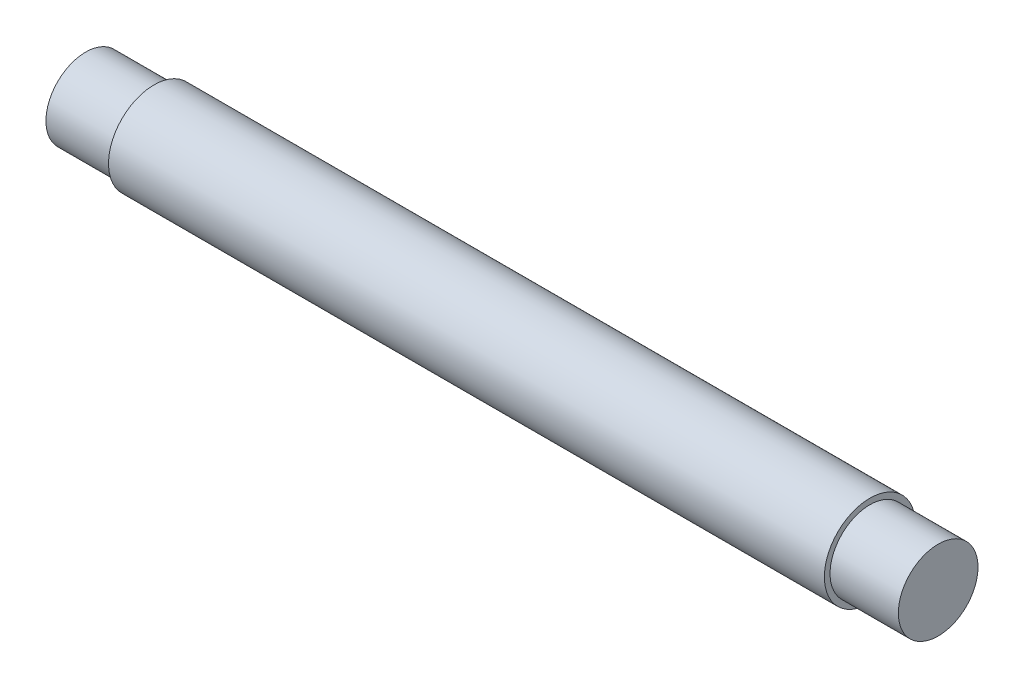
from build123d import *


with BuildPart() as part:
    # Sketch1 → Revolve1 (revolve)
    with BuildSketch(Plane(origin=(0, 0, 0), x_dir=(1, 0, 0), z_dir=(0, 1, 0))):
        Polygon((-187.25, 0), (-187.25, 17.5), (-157.25, 17.5), (-157.25, 20), (157.25, 20), (157.25, 17.5), (187.25, 17.5), (187.25, 0), align=None)
    revolve(axis=Axis((187.25, 0, 0), (-1, 0, 0)))


solid = part.part
